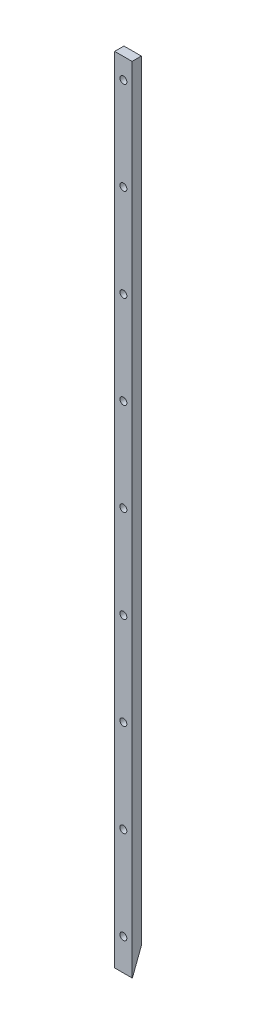
from build123d import *

# Parameters (mm, degrees)
SKETCH1_W           = 15
SKETCH1_H           = 685
BOSS_EXTRUDE1_DEPTH = 4
SKETCH2_R           = 3
CUT_EXTRUDE1_DEPTH  = 8
CHAMFER1_SIZE       = 20
CHAMFER1_SIZE2      = 7.677280701
LPATTERN1_COUNT     = 9
LPATTERN1_PITCH     = 80
CHAMFER2_SIZE       = 3


with BuildPart() as part:
    # Sketch1 → Boss-Extrude1 (new, symmetric)
    with BuildSketch(Plane.XY):
        Rectangle(SKETCH1_W, SKETCH1_H)
    extrude(amount=BOSS_EXTRUDE1_DEPTH, both=True)

    # Sketch2 → Cut-Extrude1 (cut)
    with BuildSketch(Plane.XY.offset(4)):
        with Locations((0, 324.86225561)):
            Circle(SKETCH2_R)
    cut_extrude1 = extrude(amount=-CUT_EXTRUDE1_DEPTH, mode=Mode.SUBTRACT)

    # Chamfer1
    chamfer1_edges = [part.edges().sort_by_distance(p)[0] for p in [
        (0, -342.5, -4),
    ]]
    chamfer1_side = [part.faces().sort_by_distance(p)[0] for p in [
        (0, -0.896409661, -4),
    ]]
    chamfer(chamfer1_edges, length=CHAMFER1_SIZE, length2=CHAMFER1_SIZE2, reference=chamfer1_side[0])

    # LPattern1: Cut-Extrude1 ×9
    with Locations(*[(0, -i * LPATTERN1_PITCH, 0) for i in range(1, LPATTERN1_COUNT)]):
        add(cut_extrude1, mode=Mode.SUBTRACT)

    # Chamfer2
    chamfer2_edges = [part.edges().sort_by_distance(p)[0] for p in [
        (-3, 324.86225561, -4),
        (-3, 244.86225561, -4),
        (-3, 164.86225561, -4),
        (-3, 84.86225561, -4),
        (-3, 4.86225561, -4),
        (-3, -75.13774439, -4),
        (-3, -155.13774439, -4),
        (-3, -235.13774439, -4),
        (-3, -315.13774439, -4),
    ]]
    chamfer(chamfer2_edges, length=CHAMFER2_SIZE)


solid = part.part
